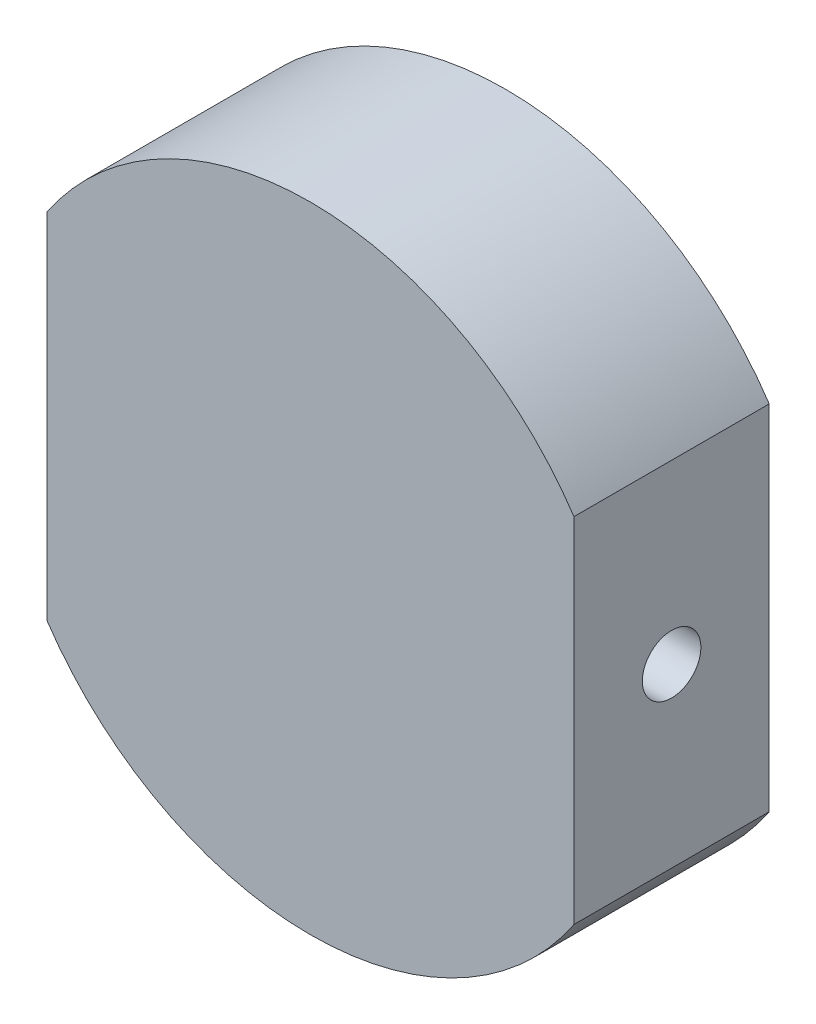
from build123d import *

# Parameters (mm, degrees)
SKETCH_3_R          = 32.5
EXTRUDE_3_DEPTH     = 20
SKETCH_4_W          = 17.889883514
SKETCH_4_H          = 45.147936345
SKETCH_4_W_2        = 17.954509811
CUT_EXTRUDE_1_DEPTH = 40
SKETCH_5_R          = 3
CUT_EXTRUDE_2_DEPTH = 60


with BuildPart() as part:
    # Эскиз3 → Вытянуть3 (new body)
    with BuildSketch(Plane.XY):
        Circle(SKETCH_3_R)
    extrude(amount=EXTRUDE_3_DEPTH)

    # Эскиз4 → Вырез-Вытянуть1 (cut, symmetric)
    with BuildSketch(Plane(origin=(0, 0, 0), x_dir=(1, 0, 0), z_dir=(0, 1, 0))):
        with Locations((-35.944941757, -4.95296847)):
            Rectangle(SKETCH_4_W, SKETCH_4_H)
        with Locations((35.977254906, -4.95296847)):
            Rectangle(SKETCH_4_W_2, SKETCH_4_H)
    extrude(amount=CUT_EXTRUDE_1_DEPTH, both=True, mode=Mode.SUBTRACT)

    # Эскиз5 → Вырез-Вытянуть2 (cut)
    with BuildSketch(Plane(origin=(27, 0, 0), x_dir=(0, 0, -1), z_dir=(1, 0, 0))):
        with Locations((-10, 0)):
            Circle(SKETCH_5_R)
    extrude(amount=-CUT_EXTRUDE_2_DEPTH, mode=Mode.SUBTRACT)


solid = part.part
